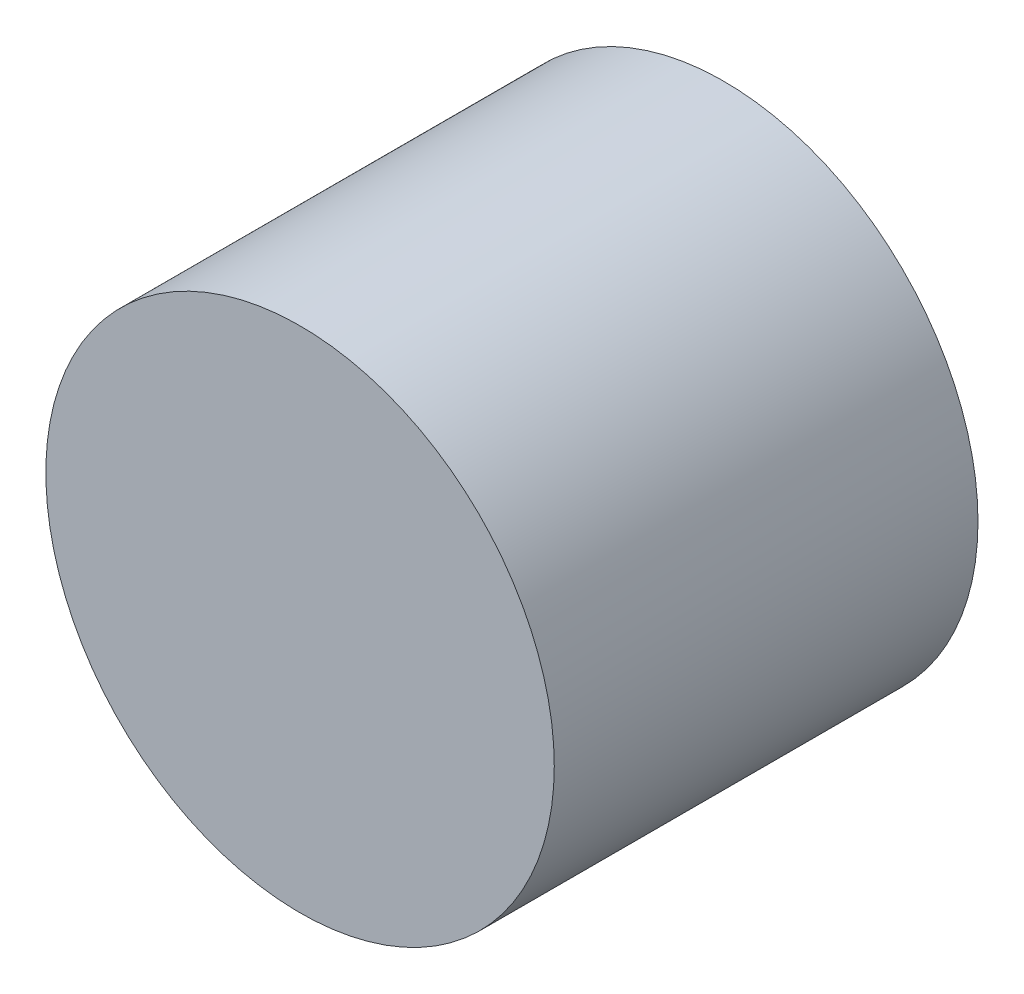
from build123d import *

# Parameters (mm, degrees)
ESQUISSE1_R        = 24
BOSS_EXTRU_1_DEPTH = 40


with BuildPart() as part:
    # Esquisse1 → Boss.-Extru.1 (new body)
    with BuildSketch(Plane.XY):
        Circle(ESQUISSE1_R)
    extrude(amount=BOSS_EXTRU_1_DEPTH)


solid = part.part
